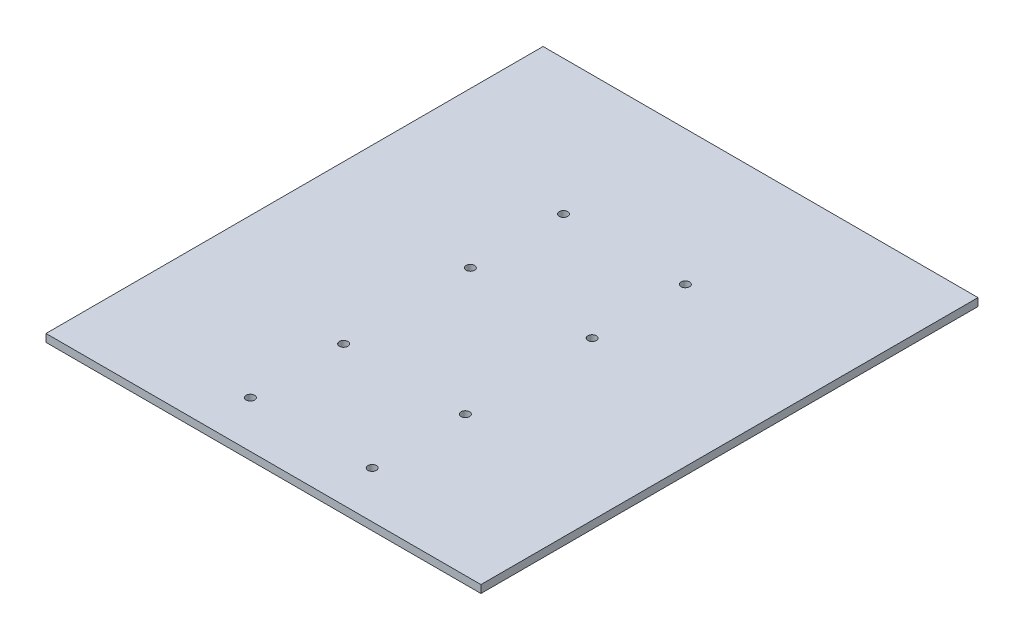
from build123d import *

# Parameters (mm, degrees)
SKETCH1_W                 = 177.8
SKETCH1_H                 = 203.2
BOSS_EXTRUDE1_DEPTH       = 3.175
TAP_DRILL_FOR_8_36_TAP1_D = 3.4544


with BuildPart() as part:
    # Sketch1 → Boss-Extrude1 (new body)
    with BuildSketch(Plane(origin=(0, 0, 0), x_dir=(1, 0, 0), z_dir=(0, 1, 0))):
        with Locations((-88.9, -101.6)):
            Rectangle(SKETCH1_W, SKETCH1_H)
    extrude(amount=BOSS_EXTRUDE1_DEPTH)

    # Tap Drill for #8-36 Tap1 (through all)
    with Locations(Plane(origin=(0, 3.175, 0), x_dir=(1, 0, 0), z_dir=(0, 1, 0))):
        with Locations((-114.3, -55.12712), (-64.511593905, -55.12712), (-64.511593905, -93.22712), (-114.3, -93.22712), (-113.288406095, -146.05), (-113.288406095, -184.15), (-63.5, -184.15), (-63.5, -146.05)):
            Hole(TAP_DRILL_FOR_8_36_TAP1_D / 2)


solid = part.part
